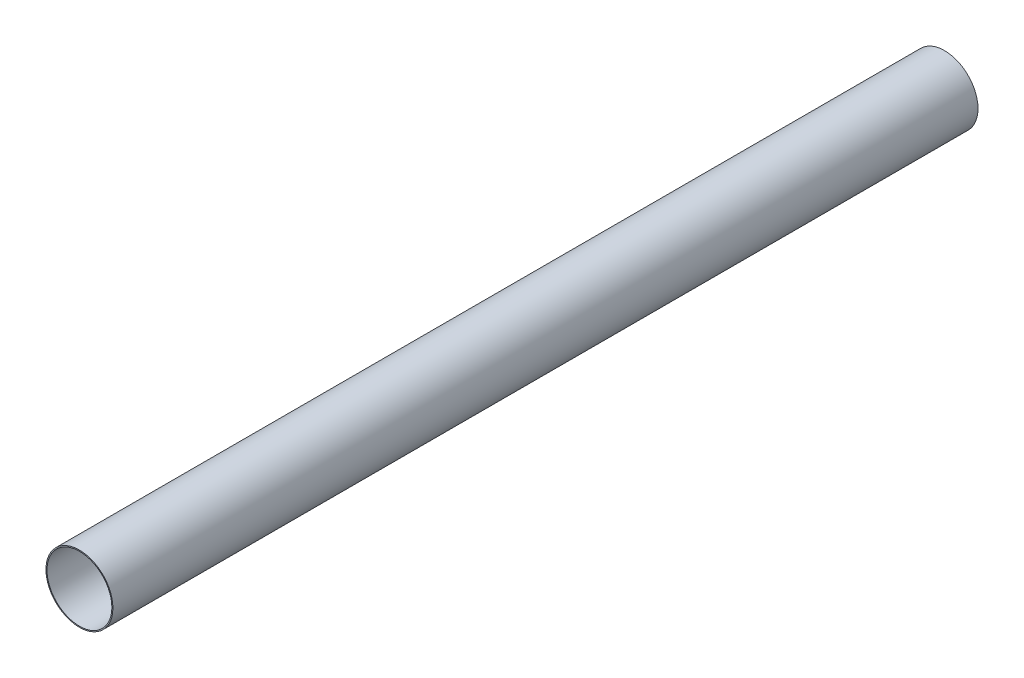
from build123d import *

# Parameters (mm, degrees)
SKETCH1_R           = 51.1175
SKETCH1_R_2         = 49.53
BOSS_EXTRUDE1_DEPTH = 1320.8


with BuildPart() as part:
    # Sketch1 → Boss-Extrude1 (new body)
    with BuildSketch(Plane.XY):
        Circle(SKETCH1_R)
        Circle(SKETCH1_R_2, mode=Mode.SUBTRACT)
    extrude(amount=BOSS_EXTRUDE1_DEPTH)


solid = part.part
